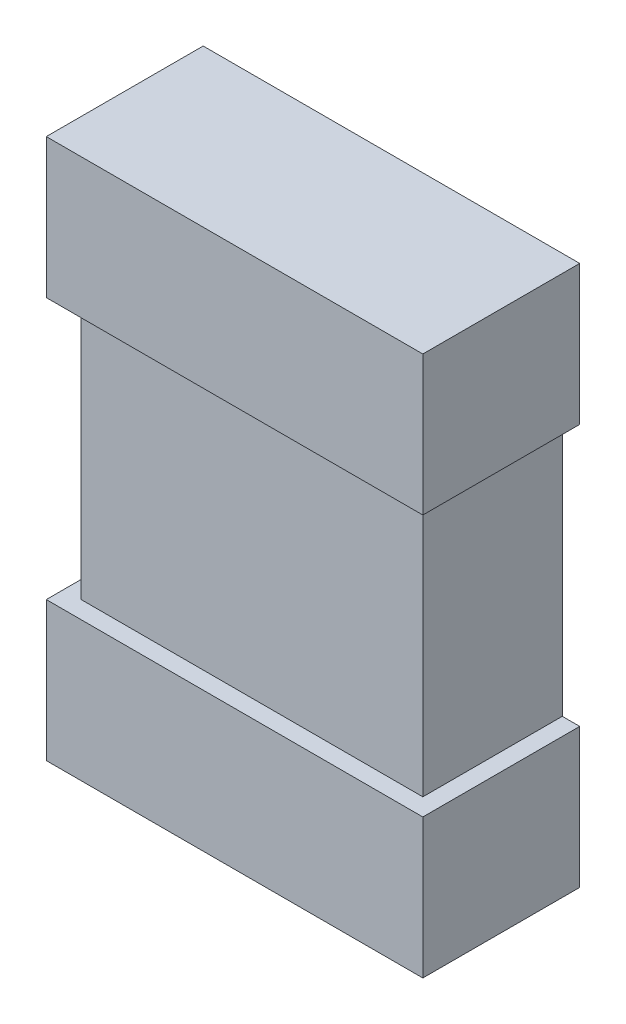
from build123d import *

# Parameters (mm, degrees)
COMPONENT_OUTLINE_W = 1.08
COMPONENT_OUTLINE_H = 1.55
EXTRUDE1_DEPTH      = 0.45
SKETCH2_W           = 0.05
SKETCH2_H           = 0.75
CUT_EXTRUDE1_DEPTH  = 2.046291068
SKETCH3_W           = 0.05
SKETCH3_H           = 0.75
CUT_EXTRUDE2_DEPTH  = 2.365293009


with BuildPart() as part:
    # COMPONENT_OUTLINE → Extrude1 (new body)
    with BuildSketch(Plane.XY):
        Rectangle(COMPONENT_OUTLINE_W, COMPONENT_OUTLINE_H)
    extrude(amount=EXTRUDE1_DEPTH)

    # Sketch2 → Cut-Extrude1 (cut, through all)
    with BuildSketch(Plane.XY.offset(0.45)):
        with Locations((-0.515, 0)):
            Rectangle(SKETCH2_W, SKETCH2_H)
        with Locations((0.515, 0)):
            Rectangle(SKETCH2_W, SKETCH2_H)
    extrude(amount=-CUT_EXTRUDE1_DEPTH, mode=Mode.SUBTRACT)

    # Sketch3 → Cut-Extrude2 (cut, through all)
    with BuildSketch(Plane(origin=(0.49, 0, 0), x_dir=(0, 0, -1), z_dir=(1, 0, 0))):
        with Locations((-0.425, 0)):
            Rectangle(SKETCH3_W, SKETCH3_H)
    extrude(amount=-CUT_EXTRUDE2_DEPTH, mode=Mode.SUBTRACT)


solid = part.part
